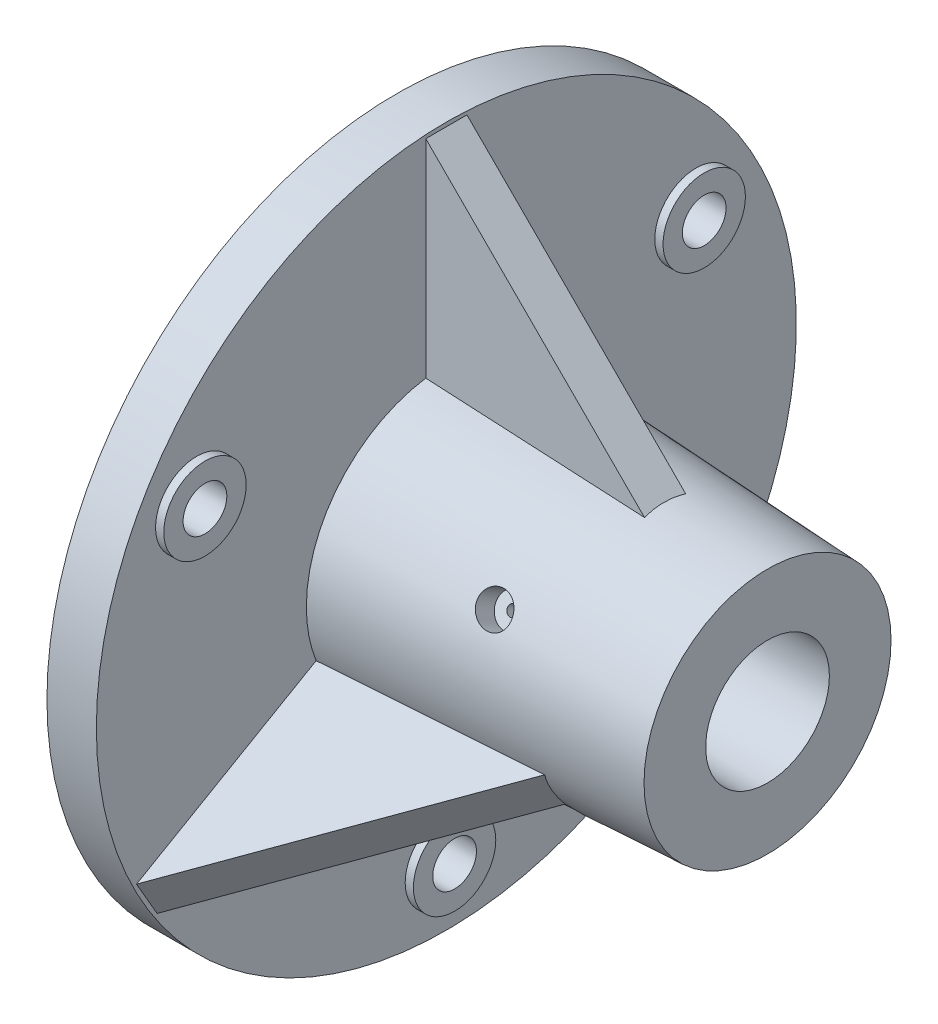
from build123d import *

# Parameters (mm, degrees)
RIB3_REACH              = 192.712
SKETCH5_WALL_W          = 478.079852118
SKETCH5_WALL_H          = 12.7
CIRPATTERN1_COUNT       = 3
SKETCH6_R               = 12.7
BOSS_EXTRUDE1_DEPTH     = 2.54
F_1_2_CLEARANCE_HOLE1_D = 13.49248
SKETCH14_R              = 19.07667
CUT_EXTRUDE1_DEPTH      = 194.798837458


with BuildPart() as part:
    # Sketch2 → Revolve2 (revolve)
    with BuildSketch(Plane.XY, mode=Mode.PRIVATE) as revolve2_sk:
        Polygon((0, 107.95), (0, 66.675), (-5.08, 66.675), (-5.08, 0), (114.3, 0), (114.3, 38.1), (15.24, 43.18), (15.24, 107.95), align=None)
    revolve(revolve2_sk.sketch.rotate(Axis((-82.761666667, 0, 0), (1, 0, 0)), 90), axis=Axis((-82.761666667, 0, 0), (1, 0, 0)))

    # Sketch5 wall → Rib3 (add, up to next)
    with BuildSketch(Plane(origin=(48.706216216, 73.213783784, 0), x_dir=(0.707106781187, -0.707106781187, 0), z_dir=(0.707106781187, 0.707106781187, 0)), mode=Mode.PRIVATE) as rib3_sk1:
        Rectangle(SKETCH5_WALL_W, SKETCH5_WALL_H)
    rib3_tool1 = extrude(rib3_sk1.sketch, amount=-RIB3_REACH, mode=Mode.PRIVATE) - part.part
    rib3 = rib3_tool1.solids().sort_by_distance((48.706216216, 73.213783784, 0))[0]
    add(rib3)

    # CirPattern1: Rib3 ×3 about axis
    cirpattern1_axis = Axis((0, 0, 0), (1, 0, 0))
    for i in range(1, CIRPATTERN1_COUNT):
        add(rib3.rotate(cirpattern1_axis, i * 360 / CIRPATTERN1_COUNT))

    # Sketch6 → Boss-Extrude1 (add)
    with BuildSketch(Plane(origin=(15.24, 0, 0), x_dir=(0, 0, -1), z_dir=(1, 0, 0))):
        with Locations(Location((76.989658396, 44.45, 0), (0, 0, 180))):
            Circle(SKETCH6_R)
        with Locations(Location((0, -88.9, 0), (0, 0, 180))):
            Circle(SKETCH6_R)
        with Locations(Location((-76.989658396, 44.45, 0), (0, 0, 180))):
            Circle(SKETCH6_R)
    extrude(amount=BOSS_EXTRUDE1_DEPTH)

    # 1/2 Clearance Hole1 (through all)
    with Locations(Plane(origin=(17.78, 0, 0), x_dir=(0, 0, -1), z_dir=(1, 0, 0))):
        with Locations((-76.989658396, 44.45), (76.989658396, 44.45), (0, -88.9)):
            Hole(F_1_2_CLEARANCE_HOLE1_D / 2)

    # Sketch13 → 1/8 NPT Tapped Hole1 (revolve, cut)
    with BuildSketch(Plane(origin=(65.257621207, 20.307496892, 35.173616392), x_dir=(0.7626361853665489, -0.5786990925818297, 0.28895226078805086), z_dir=(0.6447969431921082, 0.6447969431921082, -0.41045560551687754))):
        Polygon((0, 0), (0, 39.053866233), (1.5875, 38.1), (1.5875, 6.9342), (4.936185566, 6.9342), (5.1438048, 0), align=None)
    revolve(axis=Axis((65.582834882, 23.478330224, 40.665660824), (-0.05121475197315849, -0.4993438317382925, -0.8648888870168513)), mode=Mode.SUBTRACT)

    # Sketch14 → Cut-Extrude1 (cut, through all)
    with BuildSketch(Plane(origin=(114.3, 0, 0), x_dir=(0, 0, -1), z_dir=(1, 0, 0))):
        Circle(SKETCH14_R)
    extrude(amount=-CUT_EXTRUDE1_DEPTH, mode=Mode.SUBTRACT)


solid = part.part
